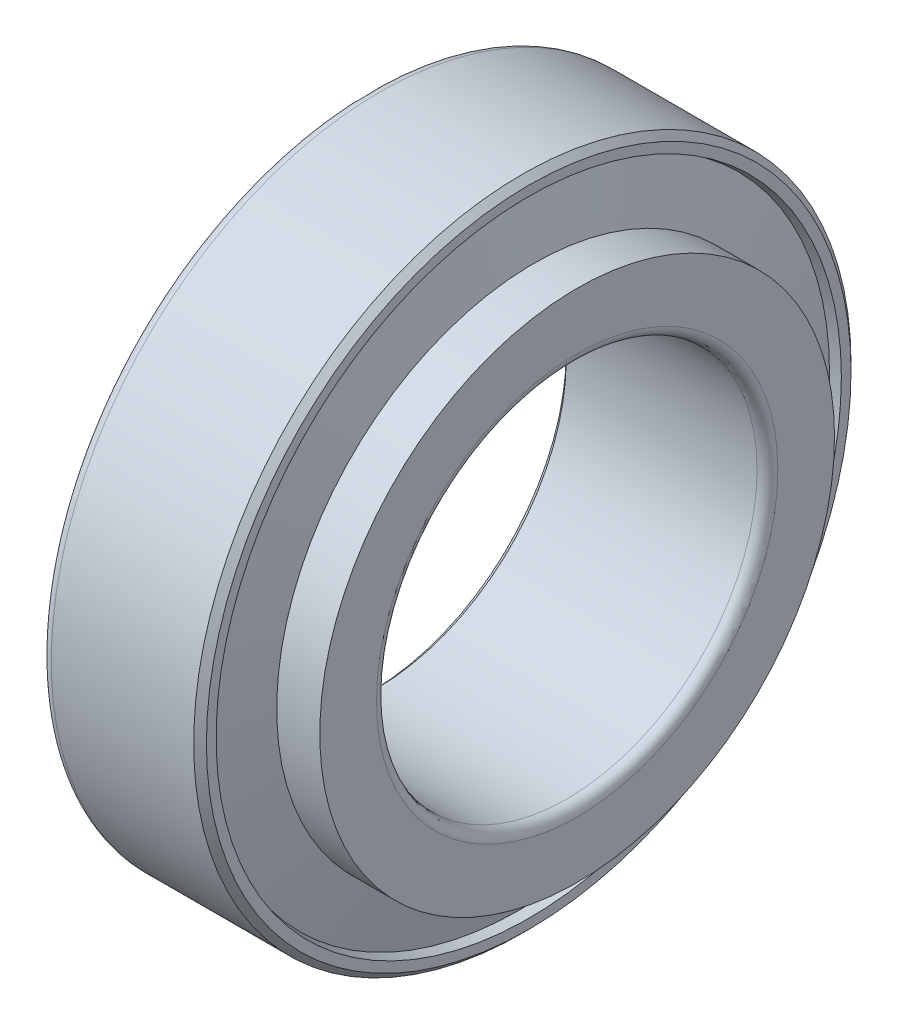
from build123d import *


with BuildPart() as part:
    # OutRacSke → OuterRace (revolve)
    with BuildSketch(Plane.XY):
        with BuildLine():
            Line((-7, 45.181544065), (-30, 39.447))
            Line((-30, 39.447), (-30, 46))
            ThreePointArc((-30, 46), (-29.560660172, 47.060660172), (-28.5, 47.5))
            Line((-28.5, 47.5), (-7.92, 47.5))
            Line((-7.92, 47.5), (-7, 46.58))
            Line((-7, 46.58), (-7, 45.181544065))
        make_face()
    revolve(axis=Axis((-42.5, 0, 0), (1, 0, 0)))

    # RolSimSke → RollersSimplified (revolve)
    with BuildSketch(Plane.XY):
        Polygon((-28.5, 40.020096964), (-8.414878466, 45.027880203), (-6.237581406, 36.295218666), (-26.32270294, 31.287435427), align=None)
    revolve(axis=Axis((0, 0, 0), (-1, 0, 0)))

    # InsRacSke → InnerRace (revolve)
    with BuildSketch(Plane.XY):
        with BuildLine():
            Line((-26.424014058, 31.737435427), (-30, 31.737435427))
            Line((-30, 31.737435427), (-30, 28.42))
            Line((-30, 28.42), (-29.08, 27.5))
            Line((-29.08, 27.5), (-1.5, 27.5))
            ThreePointArc((-1.5, 27.5), (-0.439339828, 27.939339828), (0, 29))
            Line((0, 29), (0, 37.195218666))
            Line((0, 37.195218666), (-6.226694923, 37.195218666))
            Line((-6.226694923, 37.195218666), (-6.226694923, 36.295218666))
            Line((-6.226694923, 36.295218666), (-26.311816457, 31.287435427))
            Line((-26.311816457, 31.287435427), (-26.424014058, 31.737435427))
        make_face()
    revolve(axis=Axis((-42.5, 0, 0), (1, 0, 0)))


solid = part.part
